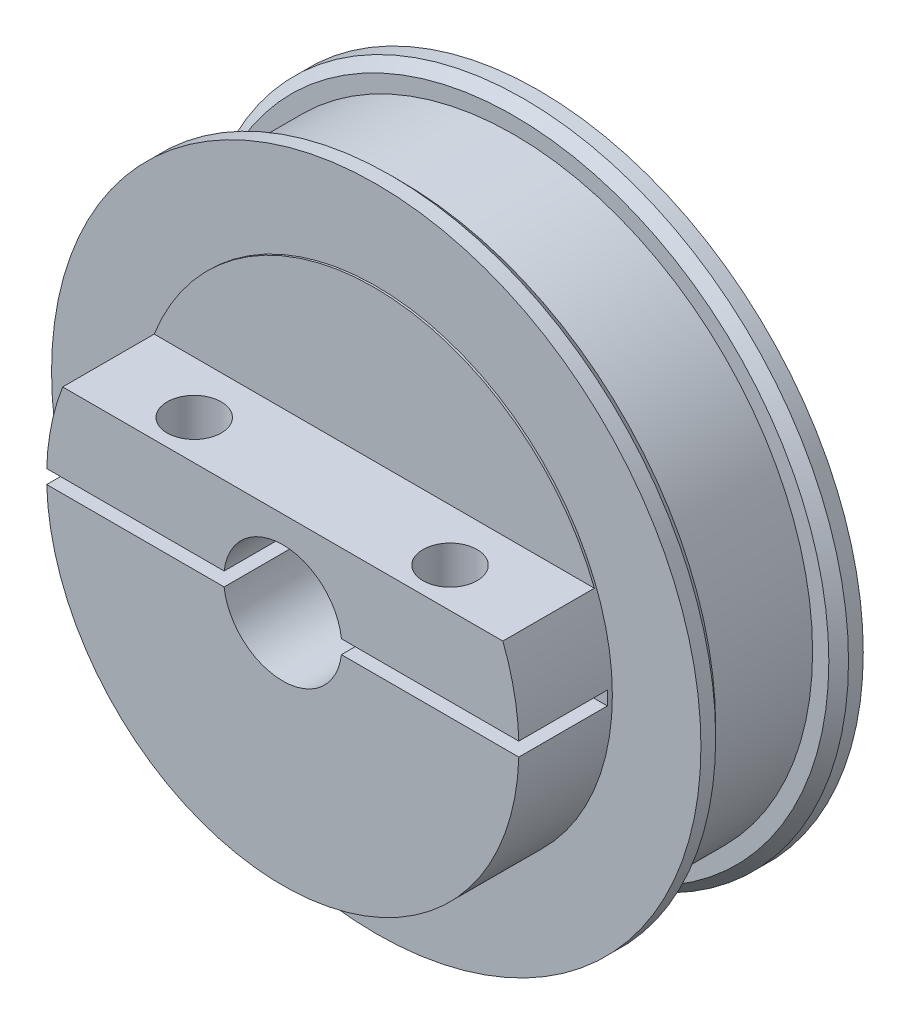
from build123d import *

# Parameters (mm, degrees)
SKETCH_1_R          = 33
EXTRUDE_1_DEPTH     = 2.5
SKETCH_2_R          = 30.35
EXTRUDE_2_DEPTH     = 11.5
SKETCH_3_R          = 33
EXTRUDE_3_DEPTH     = 2.5
SKETCH_4_R          = 24
EXTRUDE_4_DEPTH     = 9.5
CHAMFER_1_SIZE      = 1
SKETCH_5_R          = 6
CUT_EXTRUDE_1_DEPTH = 54.422841557
SKETCH_6_W          = 50
SKETCH_6_H          = 1.4
CUT_EXTRUDE_2_DEPTH = 9
SKETCH_7_R          = 2.75
CUT_EXTRUDE_3_DEPTH = 8
SKETCH_8_R          = 5
CUT_EXTRUDE_4_DEPTH = 60.193665202
HOLE_WIZARD_M5_1_D  = 4.2
SKETCH_12_W         = 10
SKETCH_12_H         = 14
CUT_EXTRUDE_5_DEPTH = 4
SKETCH_13_W         = 72.487869612
SKETCH_13_H         = 16.576438216
CUT_EXTRUDE_6_DEPTH = 9.3


with BuildPart() as part:
    # 草图1 → 凸台-拉伸1 (new body)
    with BuildSketch(Plane.XY):
        Circle(SKETCH_1_R)
    extrude(amount=EXTRUDE_1_DEPTH)

    # 草图2 → 凸台-拉伸2 (add)
    with BuildSketch(Plane.XY.offset(2.5)):
        Circle(SKETCH_2_R)
    extrude(amount=EXTRUDE_2_DEPTH)

    # 草图3 → 凸台-拉伸3 (add)
    with BuildSketch(Plane.XY.offset(14)):
        Circle(SKETCH_3_R)
    extrude(amount=EXTRUDE_3_DEPTH)

    # 草图4 → 凸台-拉伸4 (add)
    with BuildSketch(Plane.XY.offset(16.5)):
        Circle(SKETCH_4_R)
    extrude(amount=EXTRUDE_4_DEPTH)

    # 倒角1
    chamfer_1_edges = [part.edges().sort_by_distance(p)[0] for p in [
        (-33, 0, 2.5),
        (-33, 0, 14),
    ]]
    chamfer(chamfer_1_edges, length=CHAMFER_1_SIZE)

    # 草图5 → 切除-拉伸1 (cut, through all)
    with BuildSketch(Plane.XY.offset(26)):
        Circle(SKETCH_5_R)
    extrude(amount=-CUT_EXTRUDE_1_DEPTH, mode=Mode.SUBTRACT)

    # 草图6 → 切除-拉伸2 (cut)
    with BuildSketch(Plane.XY.offset(26)):
        Rectangle(SKETCH_6_W, SKETCH_6_H)
    extrude(amount=-CUT_EXTRUDE_2_DEPTH, mode=Mode.SUBTRACT)

    # 草图7 → 切除-拉伸3 (cut)
    with BuildSketch(Plane.XZ.offset(-0.7)):
        with Locations((-13, 22)):
            Circle(SKETCH_7_R)
        with Locations(Location((13, 22, 0), (0, 0, 180))):
            Circle(SKETCH_7_R)
    extrude(amount=-CUT_EXTRUDE_3_DEPTH, mode=Mode.SUBTRACT)

    # 草图8 → 切除-拉伸4 (cut, through all)
    with BuildSketch(Plane.XZ.offset(-8.7)):
        with Locations((-13, 22)):
            Circle(SKETCH_8_R)
        with Locations((13, 22)):
            Circle(SKETCH_8_R)
    extrude(amount=-CUT_EXTRUDE_4_DEPTH, mode=Mode.SUBTRACT)

    # M5 螺纹孔1 (through all)
    with Locations(Plane(origin=(0, -0.7, 0), x_dir=(-1, 0, 0), z_dir=(0, 1, 0))):
        with Locations((13, 22), (-13, 22)):
            Hole(HOLE_WIZARD_M5_1_D / 2)

    # 草图12 → 切除-拉伸5 (cut)
    with BuildSketch(Plane.XY.offset(26)):
        with Locations((-13, 15.7)):
            Rectangle(SKETCH_12_W, SKETCH_12_H)
        with Locations((13, 15.7)):
            Rectangle(SKETCH_12_W, SKETCH_12_H)
    extrude(amount=-CUT_EXTRUDE_5_DEPTH, mode=Mode.SUBTRACT)

    # 草图13 → 切除-拉伸6 (cut)
    with BuildSketch(Plane.XY.offset(26)):
        with Locations((-2.709766805, 16.988219108)):
            Rectangle(SKETCH_13_W, SKETCH_13_H)
    extrude(amount=-CUT_EXTRUDE_6_DEPTH, mode=Mode.SUBTRACT)


solid = part.part
